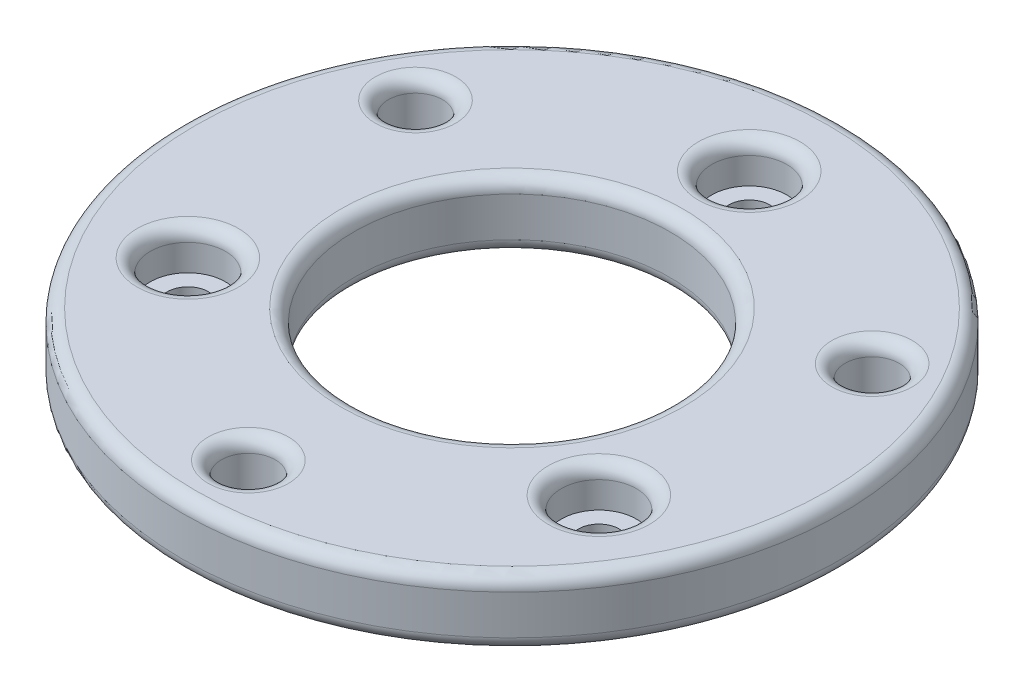
from build123d import *

# Parameters (mm, degrees)
SKETCH1_R           = 25
SKETCH1_R_2         = 12
SKETCH1_R_3         = 1.55
SKETCH1_R_4         = 2.05
BOSS_EXTRUDE1_DEPTH = 5
SKETCH2_R           = 2.85
CUT_EXTRUDE1_DEPTH  = 3
FILLET1_R           = 1


with BuildPart() as part:
    # Sketch1 → Boss-Extrude1 (new body)
    with BuildSketch(Plane(origin=(0, 0, 0), x_dir=(1, 0, 0), z_dir=(0, 1, 0))):
        with Locations(Location((0, 0, 0), (0, 0, 270))):
            Circle(SKETCH1_R)
        with Locations(Location((0, 0, 0), (0, 0, 270))):
            Circle(SKETCH1_R_2, mode=Mode.SUBTRACT)
        with Locations(Location((0, 18, 0), (0, 0, 270))):
            Circle(SKETCH1_R_3, mode=Mode.SUBTRACT)
        with Locations(Location((15.588457268, -9, 0), (0, 0, 270))):
            Circle(SKETCH1_R_3, mode=Mode.SUBTRACT)
        with Locations(Location((-15.588457268, -9, 0), (0, 0, 270))):
            Circle(SKETCH1_R_3, mode=Mode.SUBTRACT)
        with Locations(Location((0, -20, 0), (0, 0, 270))):
            Circle(SKETCH1_R_4, mode=Mode.SUBTRACT)
        with Locations(Location((-17.320508076, 10, 0), (0, 0, 270))):
            Circle(SKETCH1_R_4, mode=Mode.SUBTRACT)
        with Locations(Location((17.320508076, 10, 0), (0, 0, 270))):
            Circle(SKETCH1_R_4, mode=Mode.SUBTRACT)
    extrude(amount=BOSS_EXTRUDE1_DEPTH)

    # Sketch2 → Cut-Extrude1 (cut)
    with BuildSketch(Plane(origin=(0, 5, 0), x_dir=(1, 0, 0), z_dir=(0, 1, 0))):
        with Locations(Location((0, 18, 0), (0, 0, 270))):
            Circle(SKETCH2_R)
        with Locations(Location((15.588457268, -9, 0), (0, 0, 270))):
            Circle(SKETCH2_R)
        with Locations(Location((-15.588457268, -9, 0), (0, 0, 270))):
            Circle(SKETCH2_R)
    extrude(amount=-CUT_EXTRUDE1_DEPTH, mode=Mode.SUBTRACT)

    # Fillet1
    fillet1_edges = [part.edges().sort_by_distance(p)[0] for p in [
        (0, 0, 17.95),
        (0, 5, 17.95),
        (15.588457268, 0, 7.45),
        (0, 0, -25),
        (-15.588457268, 0, 7.45),
        (-17.320508076, 0, -12.05),
        (-17.320508076, 5, -12.05),
        (17.320508076, 0, -12.05),
        (17.320508076, 5, -12.05),
        (0, 5, -20.85),
        (0, 5, -25),
        (15.588457268, 5, 6.15),
        (-15.588457268, 5, 6.15),
        (0, 0, -12),
        (0, 5, -12),
        (0, 0, -19.55),
    ]]
    fillet(fillet1_edges, radius=FILLET1_R)


solid = part.part
